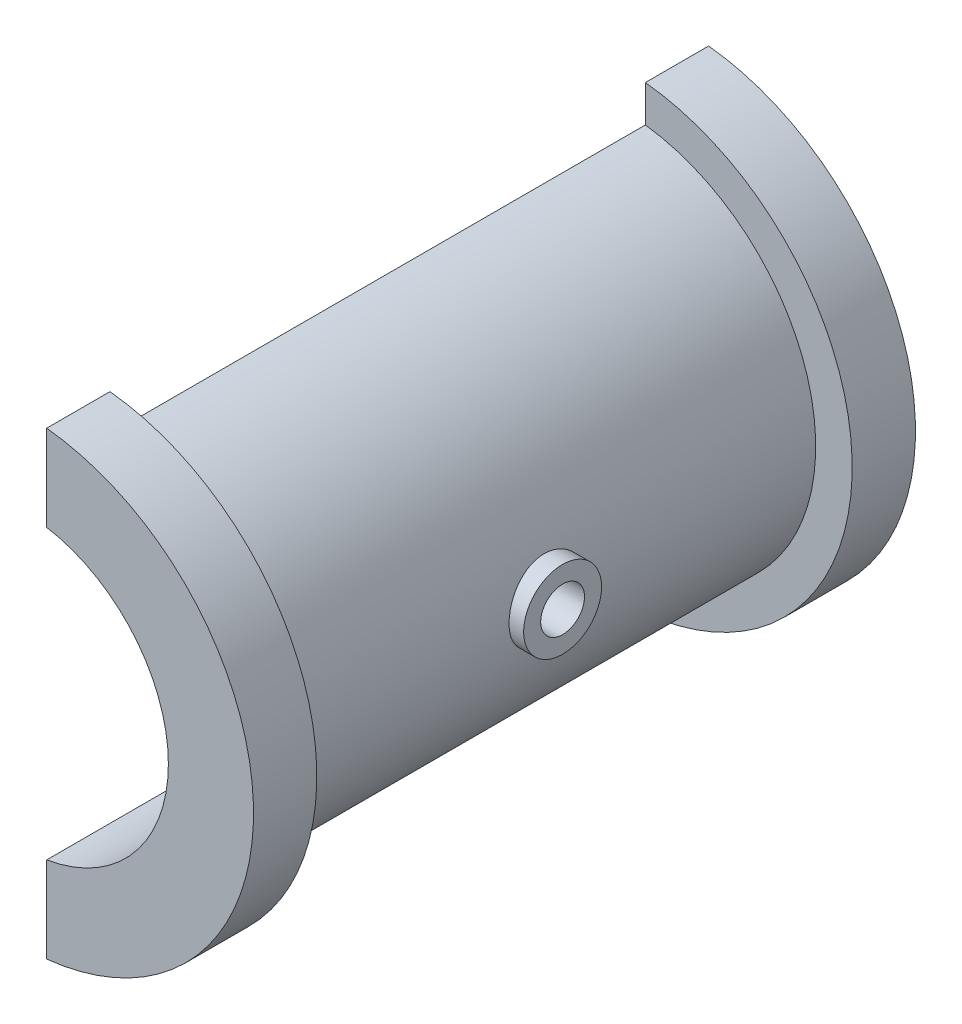
from build123d import *

# Parameters (mm, degrees)
BOSS_EXTRUDE1_DEPTH      = 55
BOSS_EXTRUDE2_START      = 13
BOSS_EXTRUDE2_DEPTH      = 13
BOSS_EXTRUDE3_REACH      = 93.1
BOSS_EXTRUDE3_END_RADIUS = 40
SKETCH3_R                = 8
HOLE1_D                  = 9


with BuildPart() as part:
    # Sketch1 → Boss-Extrude1 (new, symmetric)
    with BuildSketch(Plane.XY):
        with BuildLine():
            Line((5, 39.686269666), (5, 29.580398915))
            ThreePointArc((5, 29.580398915), (30, 0), (5, -29.580398915))
            Line((5, -29.580398915), (5, -39.686269666))
            ThreePointArc((5, -39.686269666), (40, 0), (5, 39.686269666))
        make_face()
    extrude(amount=BOSS_EXTRUDE1_DEPTH, both=True)

    # Sketch2 → Boss-Extrude2 (add)
    with BuildSketch(Plane.XY.offset(55).offset(BOSS_EXTRUDE2_START)):
        with BuildLine():
            Line((5, 29.580398915), (5, 47.236109069))
            ThreePointArc((5, 47.236109069), (47.5, 0), (5, -47.236109069))
            Line((5, -47.236109069), (5, -29.580398915))
            ThreePointArc((5, -29.580398915), (30, 0), (5, 29.580398915))
        make_face()
    boss_extrude2 = extrude(amount=-BOSS_EXTRUDE2_DEPTH)

    # Mirror1: Boss-Extrude2 across plane
    add(boss_extrude2.mirror(Plane.XY))

    # Boss-Extrude3: up to this cylinder (the profile starts outside it)
    boss_extrude3_end = Plane(origin=(0, 0, 0), z_dir=(0, 0, -1)) * Cylinder(BOSS_EXTRUDE3_END_RADIUS, 267.2, mode=Mode.PRIVATE)
    # Sketch3 → Boss-Extrude3 (add, up to the surface)
    with BuildSketch(Plane(origin=(43, 0, 0), x_dir=(0, 0, -1), z_dir=(1, 0, 0)), mode=Mode.PRIVATE) as boss_extrude3_sk1:
        Circle(SKETCH3_R)
    boss_extrude3_tool1 = extrude(boss_extrude3_sk1.sketch, amount=-BOSS_EXTRUDE3_REACH, mode=Mode.PRIVATE) - boss_extrude3_end
    add(boss_extrude3_tool1.solids().sort_by_distance((43, 0, 0))[0])

    # Hole1 (through all)
    with Locations(Plane(origin=(43, 0, 0), x_dir=(0, 0, -1), z_dir=(1, 0, 0))):
        with Locations((0, 0)):
            Hole(HOLE1_D / 2)


solid = part.part
